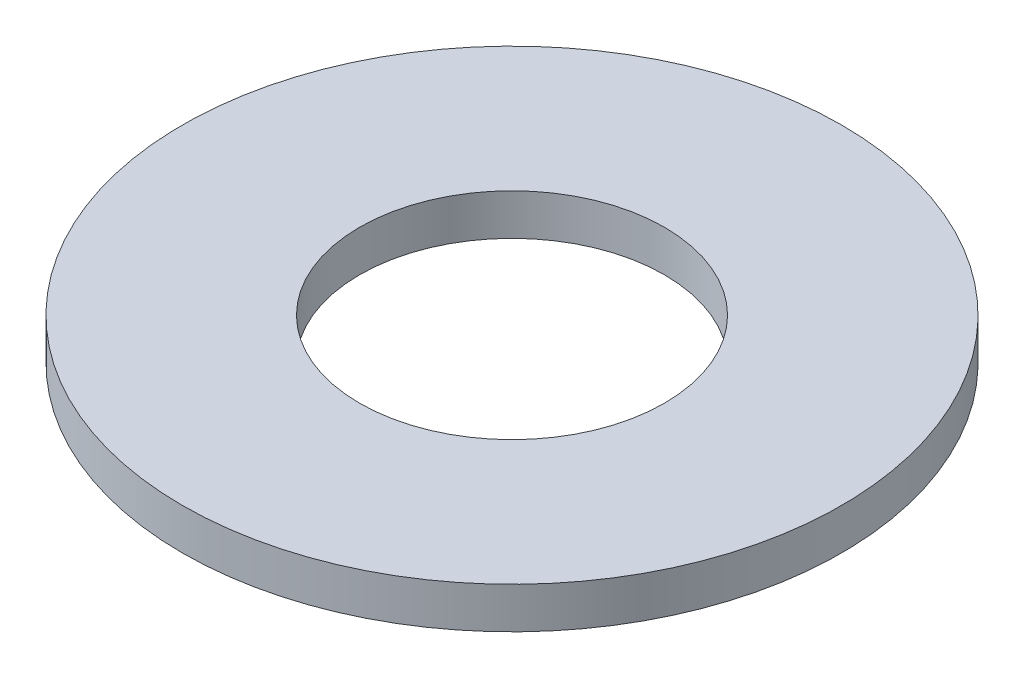
from build123d import *

# Parameters (mm, degrees)
SKETCH1_R         = 4
SKETCH1_R_2       = 1.85
WASHER_BODY_DEPTH = 0.5


with BuildPart() as part:
    # Sketch1 → Washer_Body (new body)
    with BuildSketch(Plane(origin=(0, 0, 0), x_dir=(1, 0, 0), z_dir=(0, 1, 0))):
        with Locations(Location((0, 0, 0), (0, 0, 270))):
            Circle(SKETCH1_R)
        with Locations(Location((0, 0, 0), (0, 0, 270))):
            Circle(SKETCH1_R_2, mode=Mode.SUBTRACT)
    extrude(amount=WASHER_BODY_DEPTH)


solid = part.part
